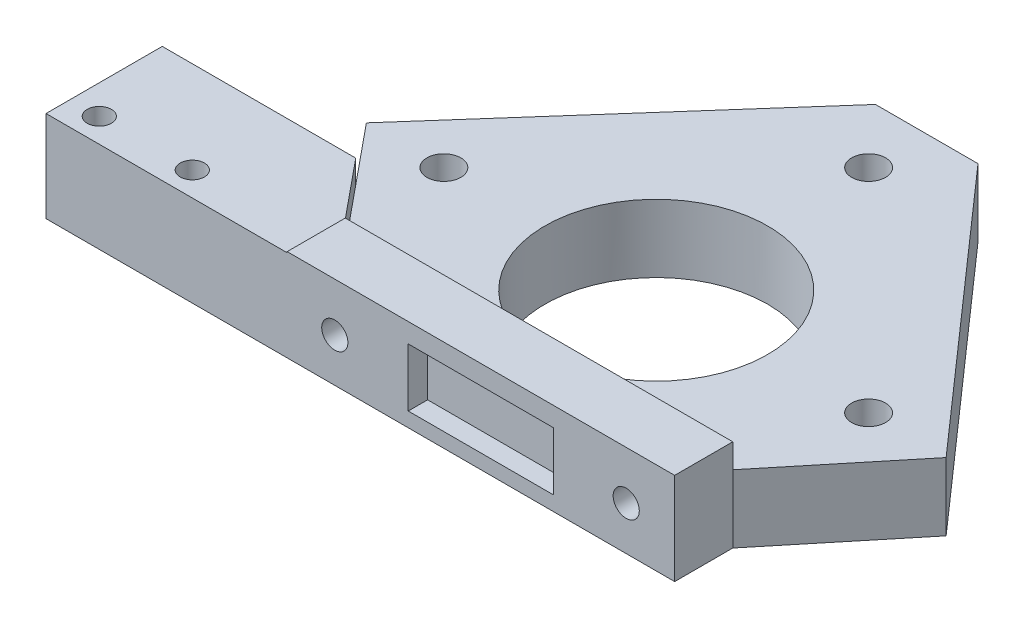
from build123d import *

# Parameters (mm, degrees)
SKETCH1_W               = 40
SKETCH1_H               = 10
SKETCH1_R               = 1.5
SKETCH1_W_2             = 15
SKETCH1_H_2             = 6
BOSS_EXTRUDE1_DEPTH     = 6
SKETCH1_3_W             = 15
SKETCH1_3_H             = 6
BOSS_EXTRUDE2_DEPTH     = 4
BOSS_EXTRUDE3_START     = -2.5
SKETCH2_R               = 1.75
SKETCH2_R_2             = 11.5
BOSS_EXTRUDE3_DEPTH     = 5
SKETCH3_W               = 40
SKETCH3_H               = 6
CUT_EXTRUDE1_DEPTH      = 0.5
BOSS_EXTRUDE4_START     = -7.5
SKETCH2_3_R             = 1.75
SKETCH2_3_R_2           = 11.5
BOSS_EXTRUDE4_DEPTH     = 2
SKETCH4_R               = 1.25
BOSS_EXTRUDE5_DEPTH     = 7
BOSS_EXTRUDE6_START     = 2.4
SKETCH4_3_R             = 1.25
BOSS_EXTRUDE6_DEPTH     = 2.4
SKETCH5_R               = 2.902241855
SKETCH5_R_2             = 1.35
SKETCH5_R_3             = 2.755762568
BOSS_EXTRUDE7_DEPTH     = 6
CUT_EXTRUDE2_DEPTH      = 69.628757271
CUT_EXTRUDE2_DEPTH_BACK = 16
SKETCH5_2_R             = 1.35


with BuildPart() as part:
    # Sketch1 → Boss-Extrude1 (new body)
    with BuildSketch(Plane.XY):
        with Locations((20, 5)):
            Rectangle(SKETCH1_W, SKETCH1_H)
        with Locations((5, 5)):
            Circle(SKETCH1_R, mode=Mode.SUBTRACT)
        with Locations((35, 5)):
            Circle(SKETCH1_R, mode=Mode.SUBTRACT)
        with Locations((20, 5)):
            Rectangle(SKETCH1_W_2, SKETCH1_H_2, mode=Mode.SUBTRACT)
    extrude(amount=BOSS_EXTRUDE1_DEPTH)

    # Sketch1<3> → Boss-Extrude2 (add)
    with BuildSketch(Plane.XY):
        with Locations((20, 5)):
            Rectangle(SKETCH1_3_W, SKETCH1_3_H)
    extrude(amount=BOSS_EXTRUDE2_DEPTH)

    # Sketch2 → Boss-Extrude3 (add)
    # profile 1 of 2: a face of its own
    with BuildSketch(Plane(origin=(0, 10, 0), x_dir=(1, 0, 0), z_dir=(0, 1, 0)).offset(BOSS_EXTRUDE3_START)):
        with BuildLine():
            Line((0, 0), (8, 0))
            Line((8, 0), (8, 12.1))
            ThreePointArc((8, 12.1), (20, 24.1), (32, 12.1))
            Line((32, 12.1), (32, 0))
            Line((32, 0), (40, 0))
            Line((40, 0), (49.920310217, 12.1))
            Line((49.920310217, 12.1), (25.291502622, 40.020310217))
            Line((25.291502622, 40.020310217), (14.708497378, 40.020310217))
            Line((14.708497378, 40.020310217), (-9.920310217, 12.1))
            Line((-9.920310217, 12.1), (0, 0))
        make_face()
        with Locations(Location((-1.920310217, 12.1, 0), (0, 0, 270))):
            Circle(SKETCH2_R, mode=Mode.SUBTRACT)
        with Locations(Location((41.920310217, 12.1, 0), (0, 0, 270))):
            Circle(SKETCH2_R, mode=Mode.SUBTRACT)
        with Locations(Location((20, 34.020310217, 0), (0, 0, 270))):
            Circle(SKETCH2_R, mode=Mode.SUBTRACT)
    # profile 2 of 2: a face of its own
    with BuildSketch(Plane(origin=(0, 10, 0), x_dir=(1, 0, 0), z_dir=(0, 1, 0)).offset(BOSS_EXTRUDE3_START)):
        with BuildLine():
            Line((8, 12.1), (8, 0))
            Line((8, 0), (32, 0))
            Line((32, 0), (32, 12.1))
            ThreePointArc((32, 12.1), (20, 24.1), (8, 12.1))
        make_face()
        with Locations(Location((20, 12.1, 0), (0, 0, 270))):
            Circle(SKETCH2_R_2, mode=Mode.SUBTRACT)
    extrude(amount=-BOSS_EXTRUDE3_DEPTH)

    # Sketch3 → Cut-Extrude1 (cut)
    with BuildSketch(Plane(origin=(0, 0, 0), x_dir=(1, 0, 0), z_dir=(0, 1, 0))):
        with Locations((20, -3)):
            Rectangle(SKETCH3_W, SKETCH3_H)
    extrude(amount=CUT_EXTRUDE1_DEPTH, mode=Mode.SUBTRACT)

    # Sketch2<3> → Boss-Extrude4 (add)
    # profile 1 of 2: a face of its own
    with BuildSketch(Plane(origin=(0, 10, 0), x_dir=(1, 0, 0), z_dir=(0, 1, 0)).offset(BOSS_EXTRUDE4_START)):
        with BuildLine():
            Line((0, 0), (8, 0))
            Line((8, 0), (8, 12.1))
            ThreePointArc((8, 12.1), (20, 24.1), (32, 12.1))
            Line((32, 12.1), (32, 0))
            Line((32, 0), (40, 0))
            Line((40, 0), (49.920310217, 12.1))
            Line((49.920310217, 12.1), (25.291502622, 40.020310217))
            Line((25.291502622, 40.020310217), (14.708497378, 40.020310217))
            Line((14.708497378, 40.020310217), (-9.920310217, 12.1))
            Line((-9.920310217, 12.1), (0, 0))
        make_face()
        with Locations(Location((-1.920310217, 12.1, 0), (0, 0, 270))):
            Circle(SKETCH2_3_R, mode=Mode.SUBTRACT)
        with Locations(Location((41.920310217, 12.1, 0), (0, 0, 270))):
            Circle(SKETCH2_3_R, mode=Mode.SUBTRACT)
        with Locations(Location((20, 34.020310217, 0), (0, 0, 270))):
            Circle(SKETCH2_3_R, mode=Mode.SUBTRACT)
    # profile 2 of 2: a face of its own
    with BuildSketch(Plane(origin=(0, 10, 0), x_dir=(1, 0, 0), z_dir=(0, 1, 0)).offset(BOSS_EXTRUDE4_START)):
        with BuildLine():
            Line((8, 12.1), (8, 0))
            Line((8, 0), (32, 0))
            Line((32, 0), (32, 12.1))
            ThreePointArc((32, 12.1), (20, 24.1), (8, 12.1))
        make_face()
        with Locations(Location((20, 12.1, 0), (0, 0, 270))):
            Circle(SKETCH2_3_R_2, mode=Mode.SUBTRACT)
    extrude(amount=-BOSS_EXTRUDE4_DEPTH)

    # Sketch4 → Boss-Extrude5 (add)
    with BuildSketch(Plane(origin=(0, 7.5, 0), x_dir=(1, 0, 0), z_dir=(0, 1, 0))):
        Polygon((-25.886515965, -6), (-24.891502622, -6), (-24.891502622, 6), (-15.301186187, 6), (-4.919162091, 6), (4.919162091, -6), align=None)
        with Locations(Location((-21.891502622, -3.5, 0), (0, 0, 270))):
            Circle(SKETCH4_R, mode=Mode.SUBTRACT)
        with Locations(Location((-12.291502622, -3.5, 0), (0, 0, 270))):
            Circle(SKETCH4_R, mode=Mode.SUBTRACT)
    extrude(amount=-BOSS_EXTRUDE5_DEPTH)

    # Sketch4<3> → Boss-Extrude6 (add)
    with BuildSketch(Plane(origin=(0, 7.5, 0), x_dir=(1, 0, 0), z_dir=(0, 1, 0)).offset(BOSS_EXTRUDE6_START)):
        Polygon((-24.891502622, 6), (-24.891502622, -6), (4.919162091, -6), (0, 0), (-4.919162091, 6), (-15.301186187, 6), align=None)
        with Locations(Location((-21.891502622, -3.5, 0), (0, 0, 270))):
            Circle(SKETCH4_3_R, mode=Mode.SUBTRACT)
        with Locations(Location((-12.291502622, -3.5, 0), (0, 0, 270))):
            Circle(SKETCH4_3_R, mode=Mode.SUBTRACT)
    extrude(amount=-BOSS_EXTRUDE6_DEPTH)

    # Sketch5 → Boss-Extrude7 (add)
    # profile 1 of 2: a face of its own
    with BuildSketch(Plane.XY.offset(6)):
        with Locations((4.919162091, 5)):
            Circle(SKETCH5_R)
        with Locations(Location((4.919162091, 5, 0), (0, 0, 90))):
            Circle(SKETCH5_R_2, mode=Mode.SUBTRACT)
    # profile 2 of 2: a face of its own
    with BuildSketch(Plane.XY.offset(6)):
        with Locations((35, 5)):
            Circle(SKETCH5_R_3)
        with Locations((35, 5)):
            Circle(SKETCH5_R_2, mode=Mode.SUBTRACT)
    extrude(amount=-BOSS_EXTRUDE7_DEPTH)

    # Sketch5<2> → Cut-Extrude2 (cut, two sides: drawn at the far end of the back side and taken through both)
    with BuildSketch(Plane.XY.offset(6).offset(-CUT_EXTRUDE2_DEPTH_BACK)):
        with BuildLine():
            ThreePointArc((4.919162091, 3.65), (5.873756246, 4.045405845), (6.269162091, 5))
            ThreePointArc((6.269162091, 5), (5.873756246, 5.954594155), (4.919162091, 6.35))
            Line((4.919162091, 6.35), (4.919162091, 3.65))
        make_face()
        with BuildLine():
            Line((4.919162091, 3.65), (4.919162091, 6.35))
            ThreePointArc((4.919162091, 6.35), (3.569162091, 5), (4.919162091, 3.65))
        make_face()
        with Locations((35, 5)):
            Circle(SKETCH5_2_R)
    extrude(amount=CUT_EXTRUDE2_DEPTH + CUT_EXTRUDE2_DEPTH_BACK, mode=Mode.SUBTRACT)


solid = part.part
